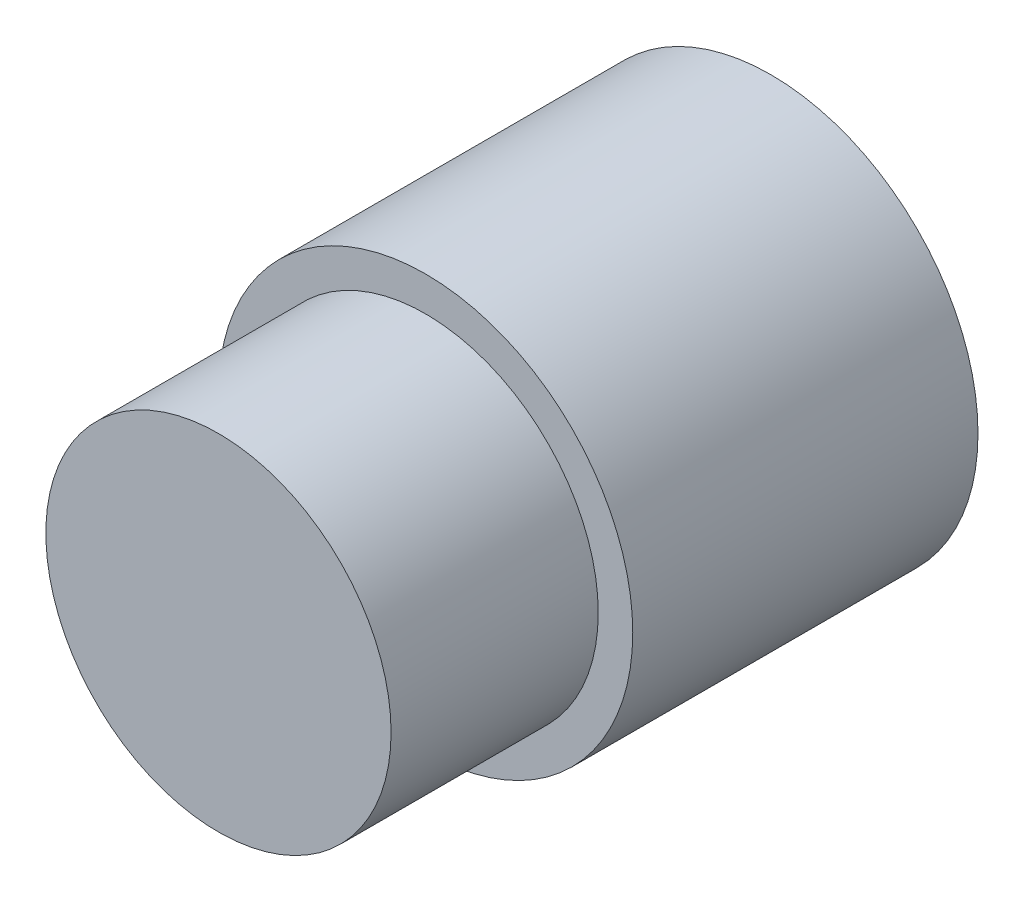
from build123d import *

# Parameters (mm, degrees)
SCHIZZO1_R                   = 3
ESTRUSIONE_ESTRUSIONE1_DEPTH = 5
SCHIZZO2_R                   = 2.5
ESTRUSIONE_ESTRUSIONE2_DEPTH = 3


with BuildPart() as part:
    # Schizzo1 → Estrusione-Estrusione1 (new body)
    with BuildSketch(Plane.XY):
        Circle(SCHIZZO1_R)
    extrude(amount=ESTRUSIONE_ESTRUSIONE1_DEPTH)

    # Schizzo2 → Estrusione-Estrusione2 (add)
    with BuildSketch(Plane.XY.offset(5)):
        Circle(SCHIZZO2_R)
    extrude(amount=ESTRUSIONE_ESTRUSIONE2_DEPTH)


solid = part.part
